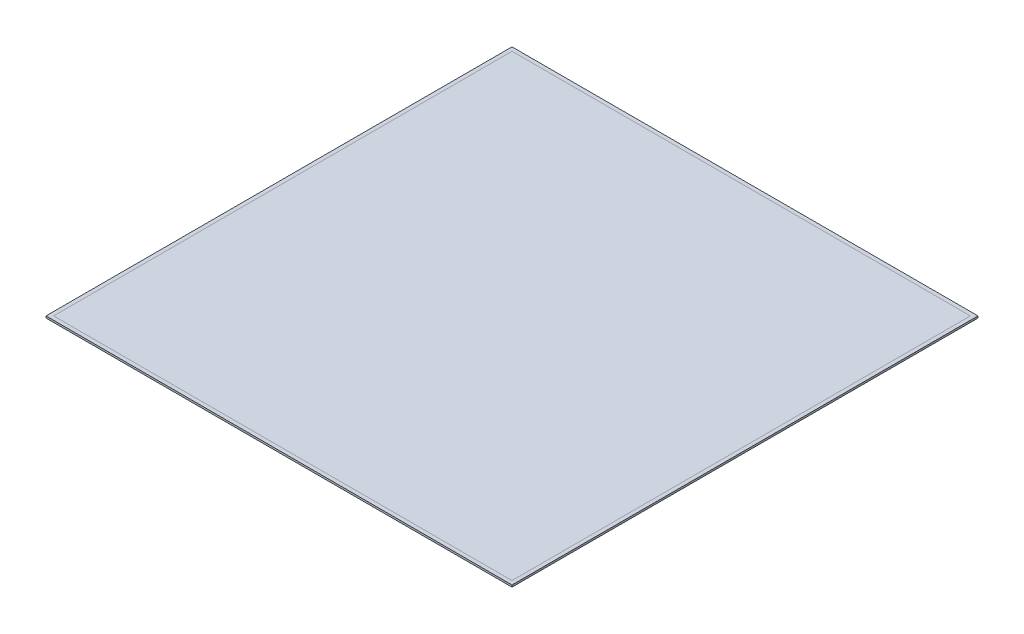
from build123d import *

# Parameters (mm, degrees)
SKETCH_4_W       = 2440
SKETCH_4_H       = 2440
SKETCH_4_W_2     = 2400
SKETCH_4_H_2     = 2400
EXTRUDE_4_DEPTH  = 10
SKETCH_5_W       = 2400
SKETCH_5_H       = 2400
EXTRUDE_6_DEPTH  = 10
SKETCH_6_W       = 300
SKETCH_6_H       = 300
EXTRUDE_9_DEPTH  = 0.1
SKETCH_7_W       = 300
SKETCH_7_H       = 300
EXTRUDE_10_DEPTH = 0.1
SKETCH_8_W       = 800
SKETCH_8_H       = 800
EXTRUDE_11_DEPTH = 0.1
SKETCH_9_W       = 840
SKETCH_9_H       = 840
SKETCH_9_W_2     = 800
SKETCH_9_H_2     = 800
EXTRUDE_13_DEPTH = 0.1


with BuildPart() as part:
    # 草图4 → 凸台-拉伸4 (new body)
    with BuildSketch(Plane(origin=(0, 0, 0), x_dir=(1, 0, 0), z_dir=(0, 1, 0))):
        Rectangle(SKETCH_4_W, SKETCH_4_H)
        Rectangle(SKETCH_4_W_2, SKETCH_4_H_2, mode=Mode.SUBTRACT)
    extrude(amount=EXTRUDE_4_DEPTH)


with BuildPart() as body_2:
    # 草图5 → 凸台-拉伸6 (new body)
    with BuildSketch(Plane(origin=(0, 10, 0), x_dir=(1, 0, 0), z_dir=(0, 1, 0))):
        Rectangle(SKETCH_5_W, SKETCH_5_H)
    extrude(amount=-EXTRUDE_6_DEPTH)


with BuildPart() as body_3:
    # 草图6 → 凸台-拉伸9 (new body)
    with BuildSketch(Plane.XZ):
        with Locations((1050, 1050)):
            Rectangle(SKETCH_6_W, SKETCH_6_H)
    extrude(amount=EXTRUDE_9_DEPTH)


with BuildPart() as body_4:
    # 草图7 → 凸台-拉伸10 (new body)
    with BuildSketch(Plane.XZ):
        with Locations((1050, -1050)):
            Rectangle(SKETCH_7_W, SKETCH_7_H)
    extrude(amount=EXTRUDE_10_DEPTH)


with BuildPart() as body_5:
    # 草图8 → 凸台-拉伸11 (new body)
    with BuildSketch(Plane.XZ):
        Rectangle(SKETCH_8_W, SKETCH_8_H)
    extrude(amount=EXTRUDE_11_DEPTH)


with BuildPart() as body_6:
    # 草图9 → 凸台-拉伸13 (new body)
    with BuildSketch(Plane.XZ):
        Rectangle(SKETCH_9_W, SKETCH_9_H)
        Rectangle(SKETCH_9_W_2, SKETCH_9_H_2, mode=Mode.SUBTRACT)
    extrude(amount=EXTRUDE_13_DEPTH)


solid = Compound([part.part, body_2.part, body_3.part, body_4.part, body_5.part, body_6.part])
